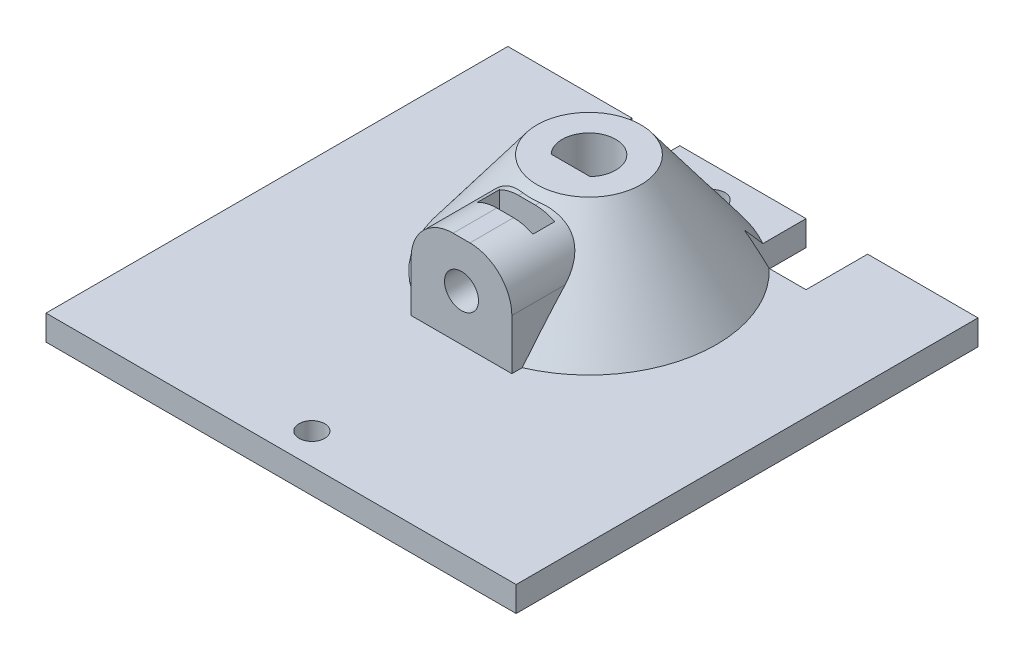
from build123d import *

# Parameters (mm, degrees)
SKETCH1_W                = 56.03
SKETCH1_H                = 55.04
BOSS_EXTRUDE1_DEPTH      = 3
SKETCH2_R                = 6.19
SKETCH2_R_2              = 3.19
BOSS_EXTRUDE2_DEPTH      = 12
BOSS_EXTRUDE3_DEPTH      = 12
BOSS_EXTRUDE4_DEPTH      = 6
BOSS_EXTRUDE4_DEPTH_BACK = 6
SKETCH7_W                = 13
SKETCH7_H                = 11
FILLET1_R                = 5
SKETCH8_R                = 2.025
CUT_EXTRUDE3_DEPTH       = 13
CUT_EXTRUDE4_DEPTH       = 1.3
CUT_EXTRUDE4_DEPTH_BACK  = 1.3
CUT_EXTRUDE5_DEPTH       = 6
CUT_EXTRUDE5_DEPTH_BACK  = 3
SKETCH10_R               = 1.525
SKETCH11_R               = 3.309100225
CUT_EXTRUDE6_DEPTH       = 80.452894865
SKETCH12_W               = 7.33
SKETCH12_H               = 7.34
SKETCH12_W_2             = 5.68
CUT_EXTRUDE7_DEPTH       = 80.96100614


with BuildPart() as part:
    # Sketch1 → Boss-Extrude1 (new body)
    with BuildSketch(Plane(origin=(0, 0, 0), x_dir=(1, 0, 0), z_dir=(0, 1, 0))):
        with Locations((28.015, 27.52)):
            Rectangle(SKETCH1_W, SKETCH1_H)
    extrude(amount=BOSS_EXTRUDE1_DEPTH)

    # Sketch2 → Boss-Extrude2 (add)
    with BuildSketch(Plane(origin=(0, 3, 0), x_dir=(1, 0, 0), z_dir=(0, 1, 0))):
        with Locations(Location((28.015, 36.693201994, 0), (0, 0, 90))):
            Circle(SKETCH2_R)
        with Locations(Location((28.015, 36.693201994, 0), (0, 0, 270))):
            Circle(SKETCH2_R_2, mode=Mode.SUBTRACT)
    extrude(amount=BOSS_EXTRUDE2_DEPTH)

    # Sketch3 → Revolve1 (revolve)
    with BuildSketch(Plane(origin=(28.015, 0, 0), x_dir=(0, 0, -1), z_dir=(1, 0, 0))):
        Polygon((39.883201994, 15), (42.883201994, 15), (51.883201994, 3), (39.883201994, 3), align=None)
    revolve(axis=Axis((28.015, 15, -36.693201994), (0, -1, 0)))

    # Sketch5 → Boss-Extrude3 (add)
    with BuildSketch(Plane(origin=(0, 15, 0), x_dir=(1, 0, 0), z_dir=(0, 1, 0))):
        Polygon((28.015, 33.503201994), (24.778253514, 33.503201994), (24.778253514, 34.503201994), (31.698194277, 34.503201994), (31.698194277, 33.503201994), align=None)
    extrude(amount=-BOSS_EXTRUDE3_DEPTH)

    # Sketch7 → Boss-Extrude4 (add, two sides: drawn at the far end of the back side and taken through both)
    with BuildSketch(Plane(origin=(28.015, 0, 0), x_dir=(0, 0, -1), z_dir=(1, 0, 0)).offset(-BOSS_EXTRUDE4_DEPTH_BACK)):
        with Locations((28.003201994, 8.5)):
            Rectangle(SKETCH7_W, SKETCH7_H)
    extrude(amount=BOSS_EXTRUDE4_DEPTH + BOSS_EXTRUDE4_DEPTH_BACK)

    # Fillet1
    fillet1_edges = [part.edges().sort_by_distance(p)[0] for p in [
        (34.015, 14, -27.354384343),
        (22.015, 14, -27.354384343),
    ]]
    fillet(fillet1_edges, radius=FILLET1_R)

    # Sketch8 → Cut-Extrude3 (cut)
    with BuildSketch(Plane.XY.offset(-21.503201994)):
        with Locations((28.015, 8.53)):
            Circle(SKETCH8_R)
    extrude(amount=-CUT_EXTRUDE3_DEPTH, mode=Mode.SUBTRACT)

    # Sketch9 → Cut-Extrude4 (cut, two sides: drawn at the far end of the back side and taken through both)
    with BuildSketch(Plane.XY.offset(-28.003201994).offset(-CUT_EXTRUDE4_DEPTH_BACK)):
        Polygon((24.715, 10.435255888), (24.715, 15), (31.315, 15), (31.315, 10.435255888), (31.315, 6.624744112), (28.015, 4.719488223), (24.715, 6.624744112), align=None)
    extrude(amount=CUT_EXTRUDE4_DEPTH + CUT_EXTRUDE4_DEPTH_BACK, mode=Mode.SUBTRACT)

    # Sketch10 → Cut-Extrude5 (cut, two sides: drawn at the far end of the back side and taken through both)
    with BuildSketch(Plane(origin=(0, 3, 0), x_dir=(1, 0, 0), z_dir=(0, 1, 0)).offset(-CUT_EXTRUDE5_DEPTH_BACK)):
        with Locations(Location((28.015, 51.37, 0), (0, 0, 90))):
            Circle(SKETCH10_R)
        with Locations(Location((28.015, 3.67, 0), (0, 0, 90))):
            Circle(SKETCH10_R)
    extrude(amount=CUT_EXTRUDE5_DEPTH + CUT_EXTRUDE5_DEPTH_BACK, mode=Mode.SUBTRACT)

    # Sketch11 → Cut-Extrude6 (cut, through all)
    with BuildSketch(Plane(origin=(0, 3, 0), x_dir=(1, 0, 0), z_dir=(0, 1, 0))):
        with Locations((28.015, 51.37)):
            Circle(SKETCH11_R)
    extrude(amount=CUT_EXTRUDE6_DEPTH, mode=Mode.SUBTRACT)

    # Sketch12 → Cut-Extrude7 (cut, through all)
    with BuildSketch(Plane.XZ):
        with Locations((39.208604027, -51.37)):
            Rectangle(SKETCH12_W, SKETCH12_H)
        with Locations((17.65, -51.37)):
            Rectangle(SKETCH12_W_2, SKETCH12_H)
    extrude(amount=-CUT_EXTRUDE7_DEPTH, mode=Mode.SUBTRACT)


solid = part.part
